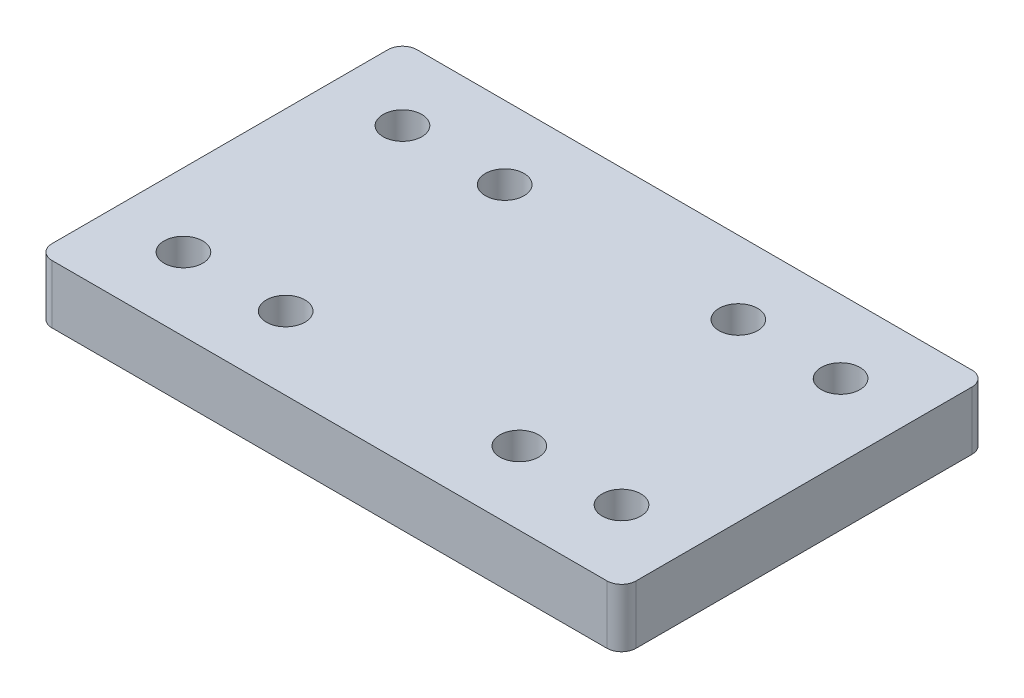
from build123d import *

# Parameters (mm, degrees)
SKETCH1_W                = 80
SKETCH1_H                = 50
BOSS_EXTRUDE1_DEPTH      = 8
FILLET1_R                = 2
M5_CLEARANCE_HOLE1_D     = 5.3
M5_CLEARANCE_HOLE1_DEPTH = 8
M5_CLEARANCE_HOLE1_TIP   = 1.59228064


with BuildPart() as part:
    # Sketch1 → Boss-Extrude1 (new body)
    with BuildSketch(Plane(origin=(0, 0, 0), x_dir=(1, 0, 0), z_dir=(0, 1, 0))):
        Rectangle(SKETCH1_W, SKETCH1_H)
    extrude(amount=BOSS_EXTRUDE1_DEPTH)

    # Fillet1
    fillet1_edges = [part.edges().sort_by_distance(p)[0] for p in [
        (-40, 4, -25),
        (40, 4, -25),
        (40, 4, 25),
        (-40, 4, 25),
    ]]
    fillet(fillet1_edges, radius=FILLET1_R)

    # M5 Clearance Hole1
    with Locations(Plane(origin=(0, 8, 0), x_dir=(1, 0, 0), z_dir=(0, 1, 0))):
        with Locations((-30, 15), (-16, 15), (-16, -15), (-30, -15), (30, -15), (16, -15), (16, 15), (30, 15)):
            Hole(M5_CLEARANCE_HOLE1_D / 2, depth=M5_CLEARANCE_HOLE1_DEPTH)
            with Locations((0, 0, -(M5_CLEARANCE_HOLE1_DEPTH + M5_CLEARANCE_HOLE1_TIP / 2))):  # 118° drill point
                Cone(0, M5_CLEARANCE_HOLE1_D / 2, M5_CLEARANCE_HOLE1_TIP, mode=Mode.SUBTRACT)


solid = part.part
